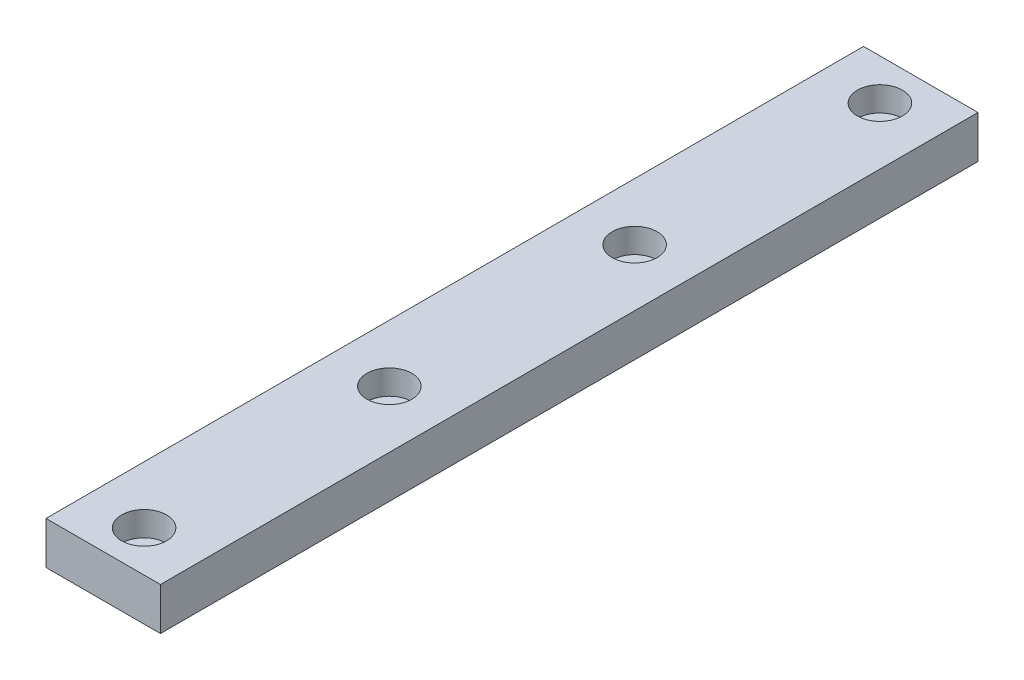
from build123d import *

# Parameters (mm, degrees)
SKETCH_1_W               = 14
SKETCH_1_H               = 5.2
EXTRUDE_1_DEPTH          = 50
SKETCH_3_R               = 2.75
CUT_EXTRUDE_1_DEPTH      = 3
CUT_EXTRUDE_2_DEPTH      = 51.754704215
CUT_EXTRUDE_2_DEPTH_BACK = 51.754704215
SKETCH_4_R               = 1.5


with BuildPart() as part:
    # 草图1 → 凸台-拉伸1 (new, symmetric)
    with BuildSketch(Plane.XY):
        Rectangle(SKETCH_1_W, SKETCH_1_H)
    extrude(amount=EXTRUDE_1_DEPTH, both=True)

    # 草图3 → 切除-拉伸1 (cut)
    with BuildSketch(Plane(origin=(0, 2.6, 0), x_dir=(1, 0, 0), z_dir=(0, 1, 0))):
        with Locations(Location((0, -45, 0), (0, 0, 270))):
            Circle(SKETCH_3_R)
        with Locations(Location((0, -15, 0), (0, 0, 270))):
            Circle(SKETCH_3_R)
        with Locations(Location((0, 15, 0), (0, 0, 270))):
            Circle(SKETCH_3_R)
        with Locations(Location((0, 45, 0), (0, 0, 270))):
            Circle(SKETCH_3_R)
    extrude(amount=-CUT_EXTRUDE_1_DEPTH, mode=Mode.SUBTRACT)

    # 草图4 → 切除-拉伸2 (cut, two sides: drawn at the far end of the back side and taken through both)
    with BuildSketch(Plane(origin=(0, 2.6, 0), x_dir=(1, 0, 0), z_dir=(0, 1, 0)).offset(-CUT_EXTRUDE_2_DEPTH_BACK)):
        with Locations(Location((0, -45, 0), (0, 0, 270))):
            Circle(SKETCH_4_R)
        with Locations(Location((0, -15, 0), (0, 0, 270))):
            Circle(SKETCH_4_R)
        with Locations(Location((0, 15, 0), (0, 0, 270))):
            Circle(SKETCH_4_R)
        with Locations(Location((0, 45, 0), (0, 0, 270))):
            Circle(SKETCH_4_R)
    extrude(amount=CUT_EXTRUDE_2_DEPTH + CUT_EXTRUDE_2_DEPTH_BACK, mode=Mode.SUBTRACT)


solid = part.part
